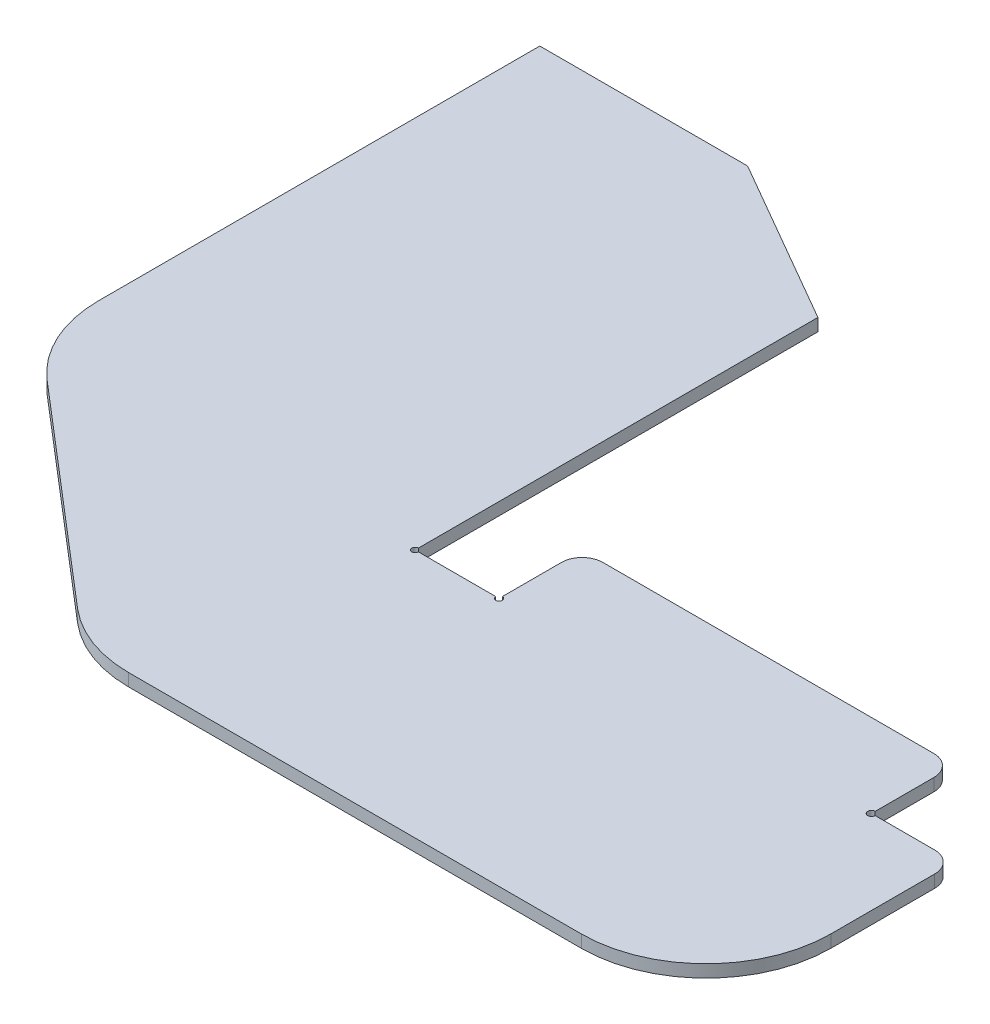
from build123d import *

# Parameters (mm, degrees)
SKETCH1_W           = 150
SKETCH1_H           = 60
BOSS_EXTRUDE1_DEPTH = 3
FILLET1_R           = 30
SKETCH2_W           = 89.6
SKETCH2_H           = 20
BOSS_EXTRUDE2_DEPTH = 3
FILLET2_R           = 30
SKETCH3_R           = 0.8
SKETCH3_R_2         = 0.899402105
CUT_EXTRUDE1_DEPTH  = 154.407952858
FILLET3_R           = 5
SKETCH4_W           = 20
SKETCH4_H           = 100
BOSS_EXTRUDE3_DEPTH = 3
BOSS_EXTRUDE4_DEPTH = 3


with BuildPart() as part:
    # Sketch1 → Boss-Extrude1 (new body)
    with BuildSketch(Plane(origin=(0, 0, 0), x_dir=(1, 0, 0), z_dir=(0, 1, 0))):
        Rectangle(SKETCH1_W, SKETCH1_H)
    extrude(amount=BOSS_EXTRUDE1_DEPTH)

    # Fillet1
    fillet1_edges = [part.edges().sort_by_distance(p)[0] for p in [
        (75, 1.5, 30),
    ]]
    fillet(fillet1_edges, radius=FILLET1_R)

    # Sketch2 → Boss-Extrude2 (add)
    with BuildSketch(Plane(origin=(0, 3, 0), x_dir=(1, 0, 0), z_dir=(0, 1, 0))):
        Polygon((-75, 30), (-55, 30), (-55, 50), (-145, 50), (-145, 30), align=None)
        Polygon((-75, -30), (-75, 30), (-145, 30), align=None)
        with Locations((10, 40)):
            Rectangle(SKETCH2_W, SKETCH2_H)
    extrude(amount=-BOSS_EXTRUDE2_DEPTH)

    # Fillet2
    fillet2_edges = [part.edges().sort_by_distance(p)[0] for p in [
        (-145, 1.5, -30),
        (-75, 1.5, 30),
    ]]
    fillet(fillet2_edges, radius=FILLET2_R)

    # Sketch3 → Cut-Extrude1 (cut, through all)
    with BuildSketch(Plane(origin=(0, 3, 0), x_dir=(1, 0, 0), z_dir=(0, 1, 0))):
        with Locations((-55, 30)):
            Circle(SKETCH3_R)
        with Locations((-34.8, 30)):
            Circle(SKETCH3_R)
        with Locations((54.8, 30)):
            Circle(SKETCH3_R_2)
    extrude(amount=-CUT_EXTRUDE1_DEPTH, mode=Mode.SUBTRACT)

    # Fillet3
    fillet3_edges = [part.edges().sort_by_distance(p)[0] for p in [
        (-34.8, 1.5, -50),
        (54.8, 1.5, -50),
        (75, 1.5, -30),
    ]]
    fillet(fillet3_edges, radius=FILLET3_R)

    # Sketch4 → Boss-Extrude3 (add)
    with BuildSketch(Plane(origin=(0, 0, 0), x_dir=(-1, 0, 0), z_dir=(0, -1, 0))):
        with Locations((135, 100)):
            Rectangle(SKETCH4_W, SKETCH4_H)
    extrude(amount=-BOSS_EXTRUDE3_DEPTH)

    # Sketch5 → Boss-Extrude4 (add)
    with BuildSketch(Plane(origin=(0, 3, 0), x_dir=(1, 0, 0), z_dir=(0, 1, 0))):
        Polygon((-55, 50), (-125, 50), (-125, 150), (-95, 150), (-55, 126.905989232), align=None)
    extrude(amount=-BOSS_EXTRUDE4_DEPTH)


solid = part.part
